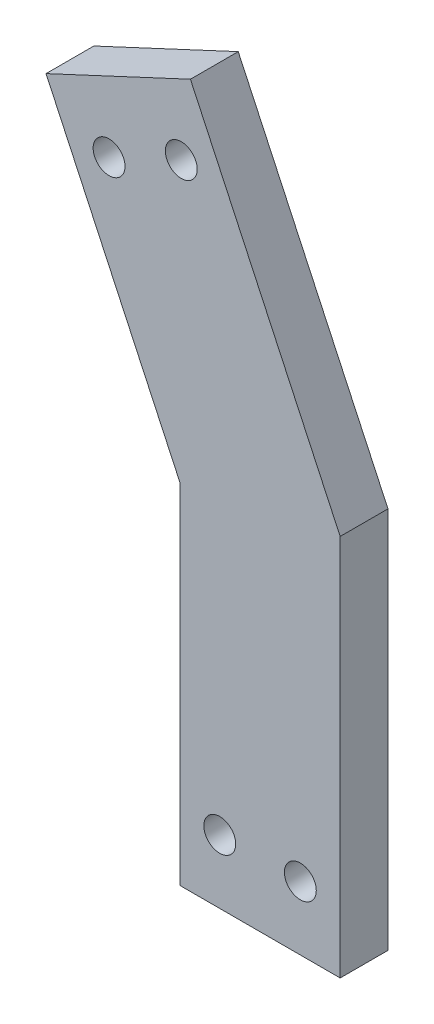
from build123d import *

# Parameters (mm, degrees)
IZIM1_R                     = 2.5
Y_KSEKLIK_EKSTR_ZYON1_DEPTH = 7.5


with BuildPart() as part:
    # Çizim1 → Yükseklik-Ekstrüzyon1 (new body)
    with BuildSketch(Plane.XY):
        Polygon((23.076112112, -55.192090606), (23.076112112, 4.807909394), (-0.418417437, 55.192090606), (-23.076112112, 44.626634063), (-2.067545518, -0.426382389), (-2.067545518, -55.192090606), align=None)
        with Locations((-13.185505826, 38.204920328)):
            Circle(IZIM1_R, mode=Mode.SUBTRACT)
        with Locations((-1.856658488, 43.4876486)):
            Circle(IZIM1_R, mode=Mode.SUBTRACT)
        with Locations((4.182454482, -45.192090606)):
            Circle(IZIM1_R, mode=Mode.SUBTRACT)
        with Locations((16.826112112, -45.192090606)):
            Circle(IZIM1_R, mode=Mode.SUBTRACT)
    extrude(amount=Y_KSEKLIK_EKSTR_ZYON1_DEPTH)


solid = part.part
